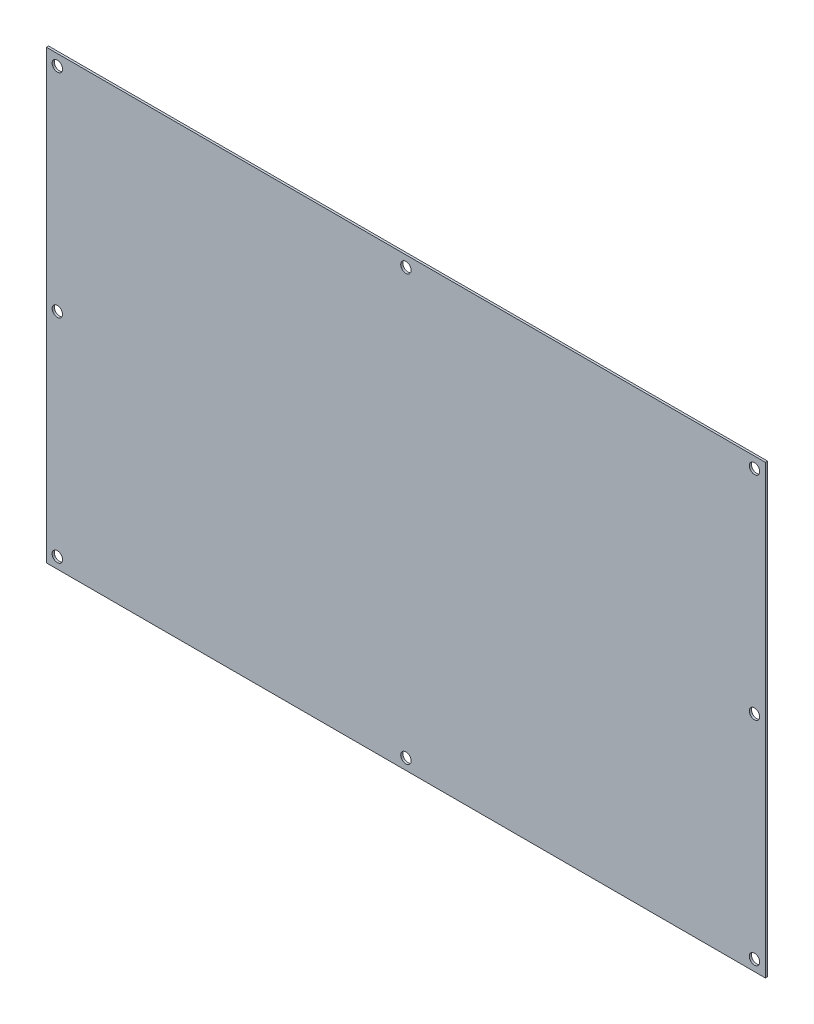
from build123d import *

# Parameters (mm, degrees)
CROQUIS1_W              = 660
CROQUIS1_H              = 410
SALIENTE_EXTRUIR1_DEPTH = 2
CROQUIS2_R              = 4.765
CROQUIS2_R_2            = 4.7625
CORTAR_EXTRUIR2_DEPTH   = 10


with BuildPart() as part:
    # Croquis1 → Saliente-Extruir1 (new body)
    with BuildSketch(Plane.XY):
        with Locations((-52, -12)):
            Rectangle(CROQUIS1_W, CROQUIS1_H)
    extrude(amount=SALIENTE_EXTRUIR1_DEPTH)

    # Croquis2 → Cortar-Extruir2 (cut)
    with BuildSketch(Plane.XY.offset(2)):
        with Locations((-372, 183)):
            Circle(CROQUIS2_R)
        with Locations(Location((268, 183, 0), (0, 0, 180))):
            Circle(CROQUIS2_R)
        with Locations((268, -207)):
            Circle(CROQUIS2_R)
        with Locations(Location((-372, -207, 0), (0, 0, 180))):
            Circle(CROQUIS2_R)
        with Locations((-372, -12)):
            Circle(CROQUIS2_R_2)
        with Locations(Location((268, -12, 0), (0, 0, 180))):
            Circle(CROQUIS2_R_2)
        with Locations((-52, 183)):
            Circle(CROQUIS2_R)
        with Locations(Location((-52, -207, 0), (0, 0, 180))):
            Circle(CROQUIS2_R)
    extrude(amount=-CORTAR_EXTRUIR2_DEPTH, mode=Mode.SUBTRACT)


solid = part.part
